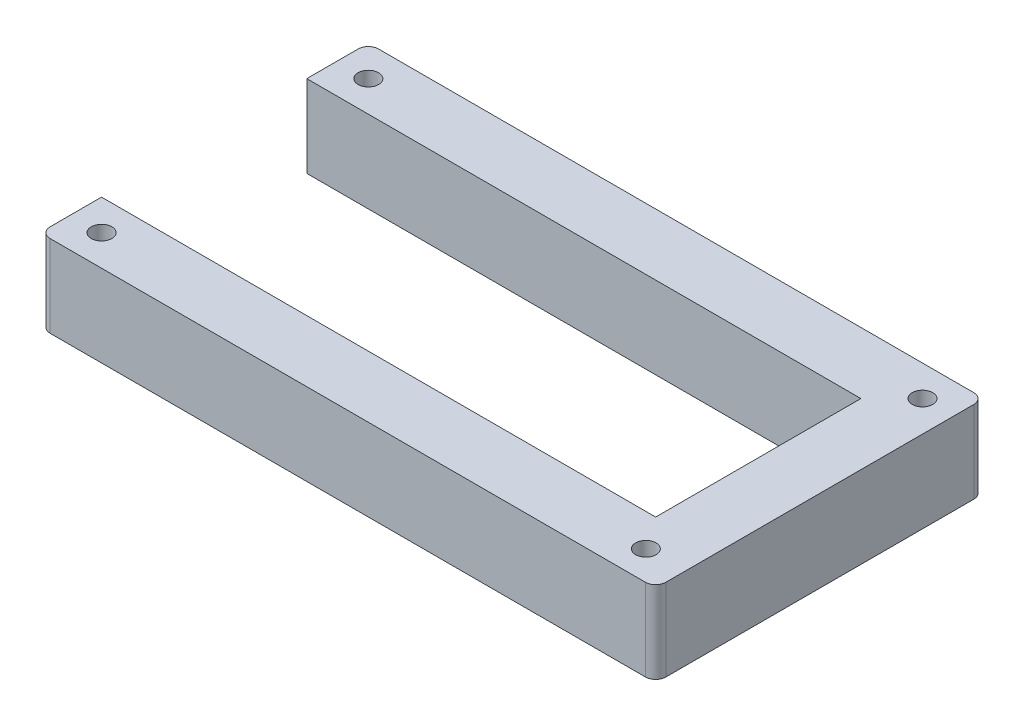
from build123d import *

# Parameters (mm, degrees)
SKETCH1_R           = 63.5
BOSS_EXTRUDE1_DEPTH = 508


with BuildPart() as part:
    # Sketch1 → Boss-Extrude1 (new body)
    with BuildSketch(Plane(origin=(0, 0, 0), x_dir=(1, 0, 0), z_dir=(0, 1, 0))):
        with BuildLine():
            Line((63.5, 0), (3746.5, 0))
            ThreePointArc((3746.5, 0), (3791.401280605, 18.598719395), (3810, 63.5))
            Line((3810, 63.5), (3810, 1968.5))
            ThreePointArc((3810, 1968.5), (3791.401280605, 2013.401280605), (3746.5, 2032))
            Line((3746.5, 2032), (63.5, 2032))
            ThreePointArc((63.5, 2032), (18.598719395, 2013.401280605), (0, 1968.5))
            Line((0, 1968.5), (0, 1651))
            Line((0, 1651), (3429, 1651))
            Line((3429, 1651), (3429, 381))
            Line((3429, 381), (0, 381))
            Line((0, 381), (0, 63.5))
            ThreePointArc((0, 63.5), (18.598719395, 18.598719395), (63.5, 0))
        make_face()
        with Locations(Location((190.5, 1841.5, 0), (0, 0, 270))):
            Circle(SKETCH1_R, mode=Mode.SUBTRACT)
        with Locations(Location((190.5, 190.5, 0), (0, 0, 270))):
            Circle(SKETCH1_R, mode=Mode.SUBTRACT)
        with Locations(Location((3568.739609568, 180.492968071, 0), (0, 0, 270))):
            Circle(SKETCH1_R, mode=Mode.SUBTRACT)
        with Locations(Location((3619.5, 1841.5, 0), (0, 0, 270))):
            Circle(SKETCH1_R, mode=Mode.SUBTRACT)
    extrude(amount=BOSS_EXTRUDE1_DEPTH)


solid = part.part
